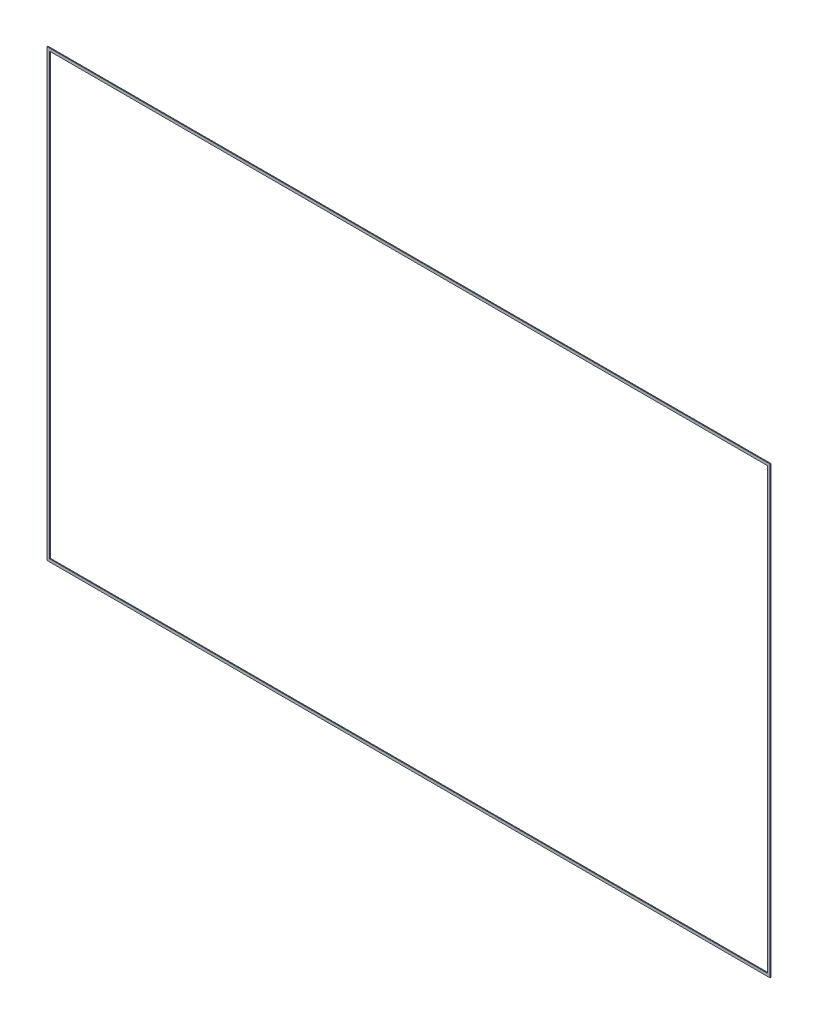
from build123d import *

# Parameters (mm, degrees)
SKETCH_1_W      = 260
SKETCH_1_H      = 160
SKETCH_1_W_2    = 258
SKETCH_1_H_2    = 158
EXTRUDE_2_DEPTH = 0.3


with BuildPart() as part:
    # 草图1 → 凸台-拉伸2 (new body)
    with BuildSketch(Plane.XY):
        with Locations((130, 80)):
            Rectangle(SKETCH_1_W, SKETCH_1_H)
        with Locations((130, 80)):
            Rectangle(SKETCH_1_W_2, SKETCH_1_H_2, mode=Mode.SUBTRACT)
    extrude(amount=EXTRUDE_2_DEPTH)


solid = part.part
